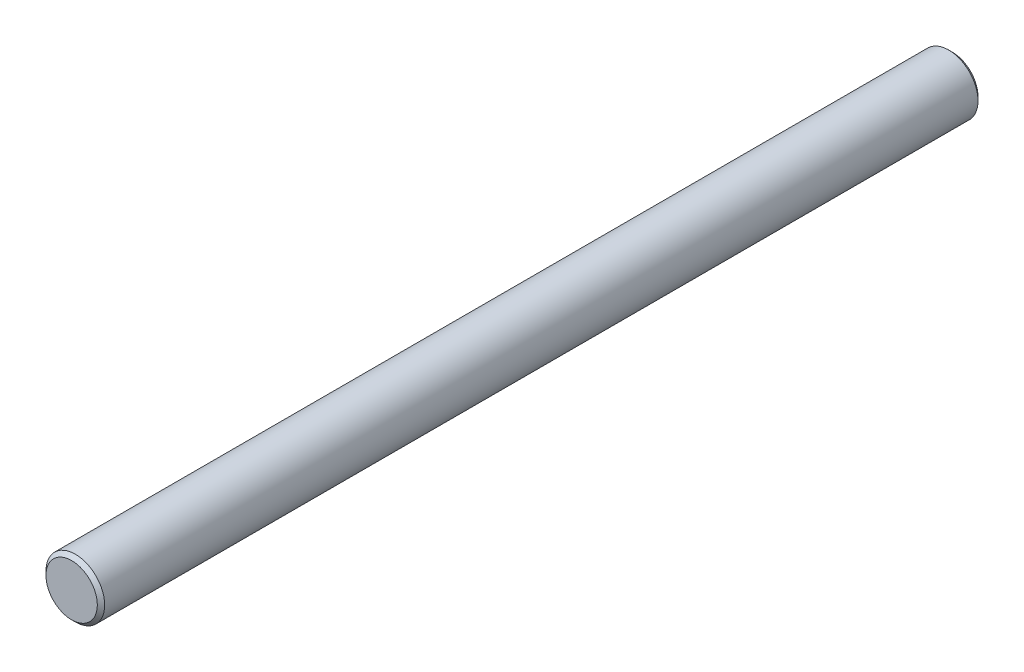
from build123d import *

# Parameters (mm, degrees)
SKETCH1_R           = 4
BOSS_EXTRUDE1_DEPTH = 120
CHAMFER1_SIZE       = 0.5


with BuildPart() as part:
    # Sketch1 → Boss-Extrude1 (new body)
    with BuildSketch(Plane.XY):
        Circle(SKETCH1_R)
    extrude(amount=BOSS_EXTRUDE1_DEPTH)

    # Chamfer1
    chamfer1_edges = [part.edges().sort_by_distance(p)[0] for p in [
        (-4, 0, 0),
        (-4, 0, 120),
    ]]
    chamfer(chamfer1_edges, length=CHAMFER1_SIZE)


solid = part.part
